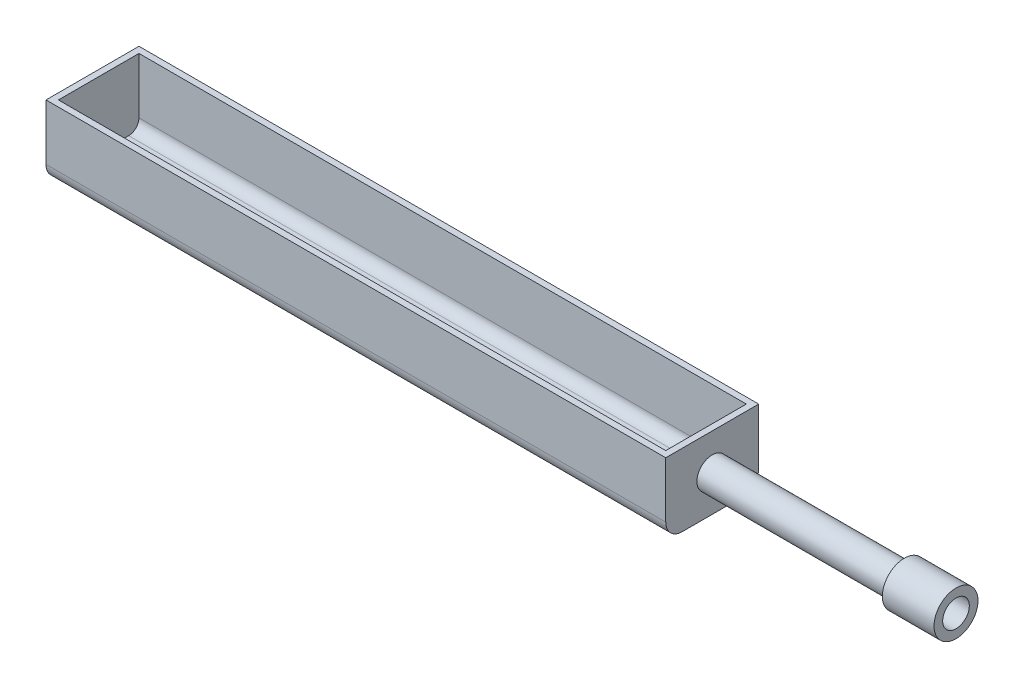
from build123d import *

# Parameters (mm, degrees)
SKETCH1_W           = 45
SKETCH1_H           = 35
BOSS_EXTRUDE1_DEPTH = 300
FILLET1_R           = 8
SHELL1_T            = -3
SKETCH3_R           = 7.45
SKETCH3_R_2         = 6.45
BOSS_EXTRUDE2_DEPTH = 103
SKETCH4_R           = 10.65
SKETCH4_R_2         = 6.45
BOSS_EXTRUDE3_DEPTH = 25


with BuildPart() as part:
    # Sketch1 → Boss-Extrude1 (new body)
    with BuildSketch(Plane(origin=(0, 0, 0), x_dir=(0, 0, -1), z_dir=(1, 0, 0))):
        Rectangle(SKETCH1_W, SKETCH1_H)
    extrude(amount=BOSS_EXTRUDE1_DEPTH)

    # Fillet1
    fillet1_edges = [part.edges().sort_by_distance(p)[0] for p in [
        (150, -17.5, -22.5),
        (150, -17.5, 22.5),
    ]]
    fillet(fillet1_edges, radius=FILLET1_R)

    # Shell1
    shell1_openings = [part.faces().sort_by_distance(p)[0] for p in [
        (150, 17.5, 0),
    ]]
    offset(amount=SHELL1_T, openings=shell1_openings, kind=Kind.INTERSECTION)

    # Sketch3 → Boss-Extrude2 (add)
    with BuildSketch(Plane(origin=(290, 0, 0), x_dir=(0, 0, -1), z_dir=(1, 0, 0))):
        Circle(SKETCH3_R)
        Circle(SKETCH3_R_2, mode=Mode.SUBTRACT)
    extrude(amount=BOSS_EXTRUDE2_DEPTH)

    # Sketch4 → Boss-Extrude3 (add)
    with BuildSketch(Plane(origin=(393, 0, 0), x_dir=(0, 0, -1), z_dir=(1, 0, 0))):
        Circle(SKETCH4_R)
        Circle(SKETCH4_R_2, mode=Mode.SUBTRACT)
    extrude(amount=BOSS_EXTRUDE3_DEPTH)


solid = part.part
